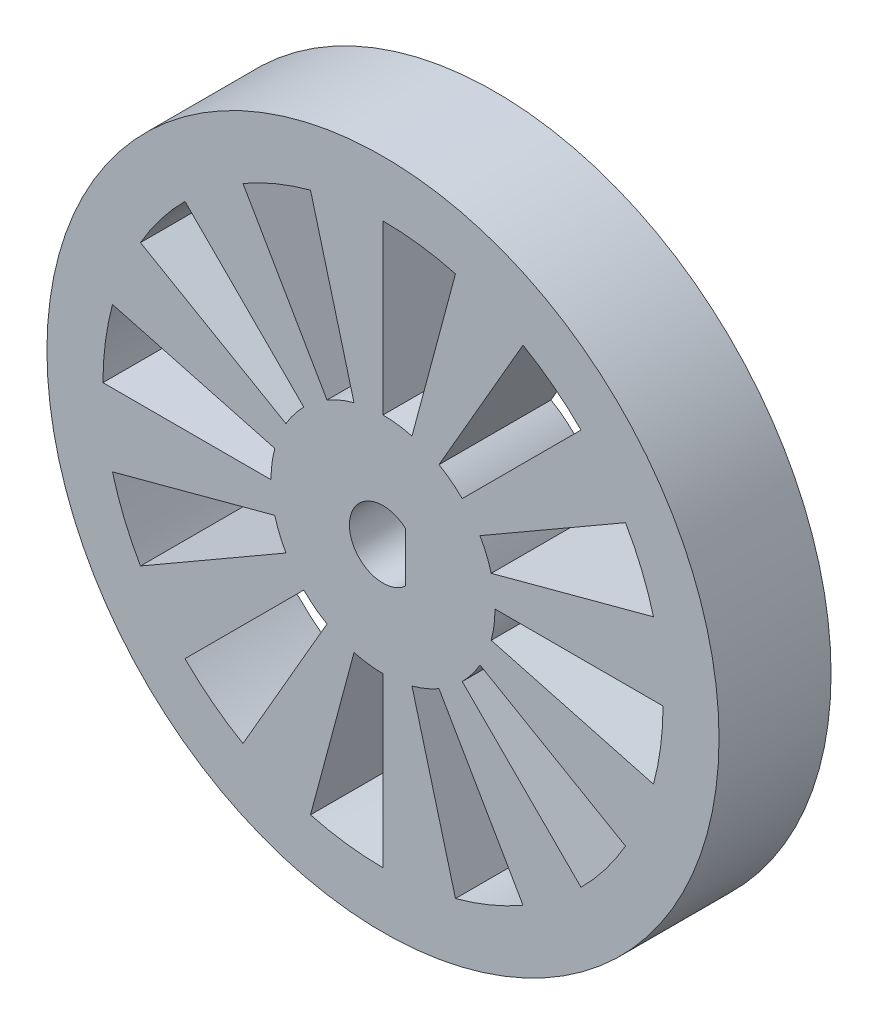
from build123d import *

# Parameters (mm, degrees)
SKETCH_2_R      = 15
EXTRUDE_1_DEPTH = 5


with BuildPart() as part:
    # 草圖2 → 填料-伸長1 (new body)
    with BuildSketch(Plane.XY):
        Circle(SKETCH_2_R)
        with BuildLine():
            Line((0, 5), (0, 12.5))
            ThreePointArc((0, 12.5), (1.631577403, 12.393060767), (3.235238064, 12.074072829))
            Line((3.235238064, 12.074072829), (1.294095226, 4.829629131))
            ThreePointArc((1.294095226, 4.829629131), (0.652630961, 4.957224307), (0, 5))
        make_face(mode=Mode.SUBTRACT)
        with BuildLine():
            Line((2.5, 4.330127019), (6.25, 10.825317547))
            ThreePointArc((6.25, 10.825317547), (7.609517863, 9.916916754), (8.838834765, 8.838834765))
            Line((8.838834765, 8.838834765), (3.535533906, 3.535533906))
            ThreePointArc((3.535533906, 3.535533906), (3.043807145, 3.966766701), (2.5, 4.330127019))
        make_face(mode=Mode.SUBTRACT)
        with BuildLine():
            Line((4.330127019, 2.5), (10.825317547, 6.25))
            ThreePointArc((10.825317547, 6.25), (11.548494156, 4.783542905), (12.074072829, 3.235238064))
            Line((12.074072829, 3.235238064), (4.829629131, 1.294095226))
            ThreePointArc((4.829629131, 1.294095226), (4.619397663, 1.913417162), (4.330127019, 2.5))
        make_face(mode=Mode.SUBTRACT)
        with BuildLine():
            Line((5, 0), (12.5, 0))
            ThreePointArc((12.5, 0), (12.393060767, -1.631577403), (12.074072829, -3.235238064))
            Line((12.074072829, -3.235238064), (4.829629131, -1.294095226))
            ThreePointArc((4.829629131, -1.294095226), (4.957224307, -0.652630961), (5, 0))
        make_face(mode=Mode.SUBTRACT)
        with BuildLine():
            Line((4.330127019, -2.5), (10.825317547, -6.25))
            ThreePointArc((10.825317547, -6.25), (9.916916754, -7.609517863), (8.838834765, -8.838834765))
            Line((8.838834765, -8.838834765), (3.535533906, -3.535533906))
            ThreePointArc((3.535533906, -3.535533906), (3.966766701, -3.043807145), (4.330127019, -2.5))
        make_face(mode=Mode.SUBTRACT)
        with BuildLine():
            Line((2.5, -4.330127019), (6.25, -10.825317547))
            ThreePointArc((6.25, -10.825317547), (4.783542905, -11.548494156), (3.235238064, -12.074072829))
            Line((3.235238064, -12.074072829), (1.294095226, -4.829629131))
            ThreePointArc((1.294095226, -4.829629131), (1.913417162, -4.619397663), (2.5, -4.330127019))
        make_face(mode=Mode.SUBTRACT)
        with BuildLine():
            Line((0, -5), (0, -12.5))
            ThreePointArc((0, -12.5), (-1.631577403, -12.393060767), (-3.235238064, -12.074072829))
            Line((-3.235238064, -12.074072829), (-1.294095226, -4.829629131))
            ThreePointArc((-1.294095226, -4.829629131), (-0.652630961, -4.957224307), (0, -5))
        make_face(mode=Mode.SUBTRACT)
        with BuildLine():
            Line((-2.5, -4.330127019), (-6.25, -10.825317547))
            ThreePointArc((-6.25, -10.825317547), (-7.609517863, -9.916916754), (-8.838834765, -8.838834765))
            Line((-8.838834765, -8.838834765), (-3.535533906, -3.535533906))
            ThreePointArc((-3.535533906, -3.535533906), (-3.043807145, -3.966766701), (-2.5, -4.330127019))
        make_face(mode=Mode.SUBTRACT)
        with BuildLine():
            Line((-4.330127019, -2.5), (-10.825317547, -6.25))
            ThreePointArc((-10.825317547, -6.25), (-11.548494156, -4.783542905), (-12.074072829, -3.235238064))
            Line((-12.074072829, -3.235238064), (-4.829629131, -1.294095226))
            ThreePointArc((-4.829629131, -1.294095226), (-4.619397663, -1.913417162), (-4.330127019, -2.5))
        make_face(mode=Mode.SUBTRACT)
        with BuildLine():
            Line((-5, 0), (-12.5, 0))
            ThreePointArc((-12.5, 0), (-12.393060767, 1.631577403), (-12.074072829, 3.235238064))
            Line((-12.074072829, 3.235238064), (-4.829629131, 1.294095226))
            ThreePointArc((-4.829629131, 1.294095226), (-4.957224307, 0.652630961), (-5, 0))
        make_face(mode=Mode.SUBTRACT)
        with BuildLine():
            Line((-4.330127019, 2.5), (-10.825317547, 6.25))
            ThreePointArc((-10.825317547, 6.25), (-9.916916754, 7.609517863), (-8.838834765, 8.838834765))
            Line((-8.838834765, 8.838834765), (-3.535533906, 3.535533906))
            ThreePointArc((-3.535533906, 3.535533906), (-3.966766701, 3.043807145), (-4.330127019, 2.5))
        make_face(mode=Mode.SUBTRACT)
        with BuildLine():
            Line((-2.5, 4.330127019), (-6.25, 10.825317547))
            ThreePointArc((-6.25, 10.825317547), (-4.783542905, 11.548494156), (-3.235238064, 12.074072829))
            Line((-3.235238064, 12.074072829), (-1.294095226, 4.829629131))
            ThreePointArc((-1.294095226, 4.829629131), (-1.913417162, 4.619397663), (-2.5, 4.330127019))
        make_face(mode=Mode.SUBTRACT)
        with BuildLine():
            Line((1, -1.118033989), (1, 1.118033989))
            ThreePointArc((1, 1.118033989), (-1.5, 0), (1, -1.118033989))
        make_face(mode=Mode.SUBTRACT)
    extrude(amount=EXTRUDE_1_DEPTH)


solid = part.part
